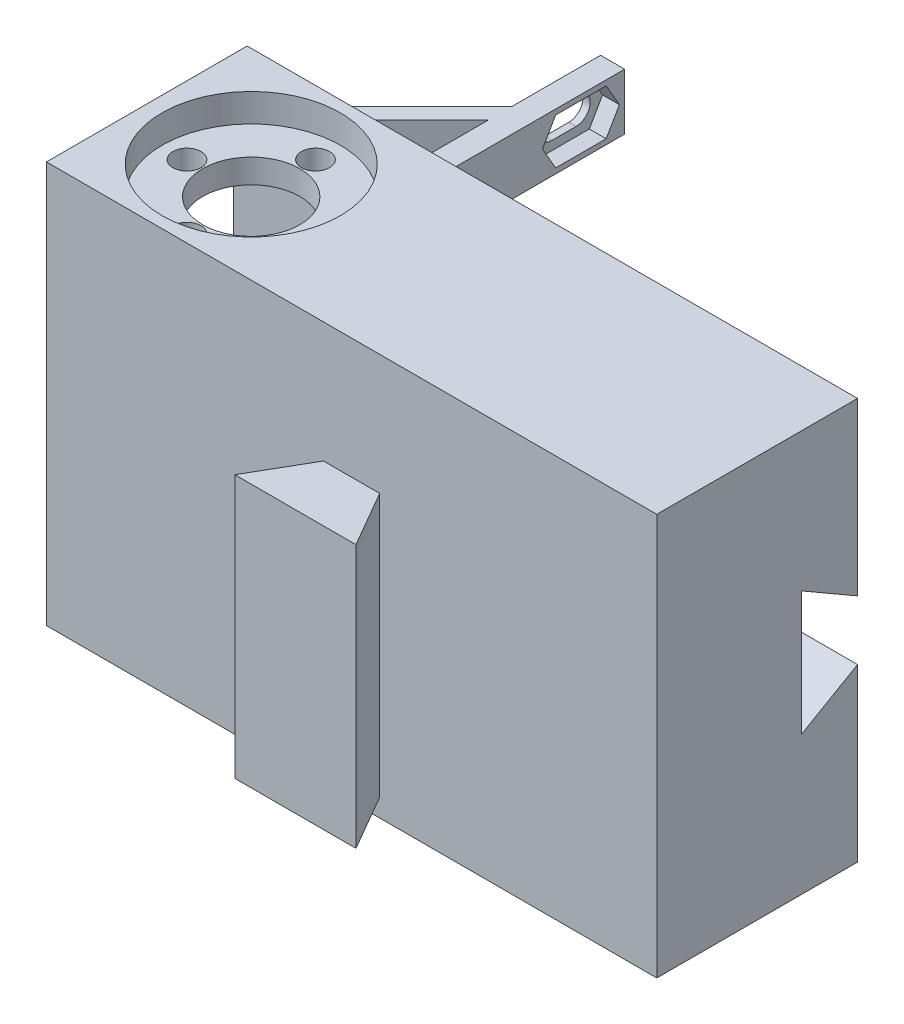
from build123d import *

# Parameters (mm, degrees)
SKETCH1_W                       = 38
SKETCH1_H                       = 50
BOSS_EXTRUDE1_DEPTH             = 25
BOSS_EXTRUDE2_START             = -22.75
BOSS_EXTRUDE2_DEPTH             = 32.75
CUT_EXTRUDE1_DEPTH              = 10
CUT_EXTRUDE2_REACH              = 88.168
CUT_EXTRUDE2_DIRECTION_2_DEPTH  = 87.168439698
SKETCH15_R                      = 11.1
CUT_EXTRUDE8_DEPTH              = 3.5
SKETCH16_R                      = 6.05
CUT_EXTRUDE9_DEPTH              = 19
SKETCH17_R                      = 6.05
CUT_EXTRUDE10_DEPTH             = 5.8
CUT_EXTRUDE11_START             = -16
CUT_EXTRUDE11_DEPTH             = 16
SKETCH19_R                      = 1.75
CUT_EXTRUDE12_DEPTH             = 19
CIRPATTERN1_COUNT               = 2
CIRPATTERN1_ANGLE               = 90
CIRPATTERN1_THE_OTHER_WAY_COUNT = 2
CIRPATTERN1_THE_OTHER_WAY_ANGLE = 90
SKETCH20_R                      = 4.15
CUT_EXTRUDE13_DEPTH             = 58.174207472
SKETCH21_R                      = 1.75
CUT_EXTRUDE14_DEPTH             = 16
SKETCH22_W                      = 3
SKETCH22_H                      = 7
BOSS_EXTRUDE5_DEPTH             = 25
CUT_EXTRUDE15_DEPTH             = 10
CUT_EXTRUDE16_START             = 2.1
CUT_EXTRUDE16_DEPTH             = 2.1
BOSS_EXTRUDE7_DEPTH             = 7
BOSS_EXTRUDE8_DEPTH             = 7


with BuildPart() as part:
    # Sketch1 → Boss-Extrude1 (new body)
    with BuildSketch(Plane.XY):
        with Locations((-19, 0)):
            Rectangle(SKETCH1_W, SKETCH1_H)
    boss_extrude1 = extrude(amount=BOSS_EXTRUDE1_DEPTH)

    # Sketch2 → Boss-Extrude2 (add)
    with BuildSketch(Plane(origin=(0, 0, 0), x_dir=(0, 0, -1), z_dir=(0, 1, 0)).offset(BOSS_EXTRUDE2_START)):
        Polygon((-25, 0), (-25, 3.5), (-32, 7.541451884), (-32, 0), align=None)
    boss_extrude2 = extrude(amount=BOSS_EXTRUDE2_DEPTH)

    # Sketch3 → Cut-Extrude1 (cut)
    with BuildSketch(Plane(origin=(0, 0, 0), x_dir=(0, 0, -1), z_dir=(1, 0, 0))):
        Polygon((0, -3.7), (0, 3.7), (-7, 7.741451884), (-7, -7.741451884), align=None)
    cut_extrude1 = extrude(amount=-CUT_EXTRUDE1_DEPTH, mode=Mode.SUBTRACT)

    # Mirror1: Boss-Extrude1, Boss-Extrude2, Cut-Extrude1 across plane
    add(boss_extrude1.mirror(Plane(origin=(0, 0, 0), x_dir=(0, 0, 1), z_dir=(1, 0, 0))))
    add(boss_extrude2.mirror(Plane(origin=(0, 0, 0), x_dir=(0, 0, 1), z_dir=(1, 0, 0))))
    add(cut_extrude1.mirror(Plane(origin=(0, 0, 0), x_dir=(0, 0, 1), z_dir=(1, 0, 0))), mode=Mode.SUBTRACT)

    # Sketch4 → Cut-Extrude2 (cut, up to next)
    with BuildSketch(Plane(origin=(38, 0, 0), x_dir=(0, 0, -1), z_dir=(1, 0, 0)), mode=Mode.PRIVATE) as cut_extrude2_sk1:
        Polygon((0, -3.7), (0, 3.7), (-7, 7.741451884), (-7, -7.741451884), align=None)
    cut_extrude2_tool1 = extrude(cut_extrude2_sk1.sketch, amount=-CUT_EXTRUDE2_REACH, mode=Mode.PRIVATE) & part.part
    add(cut_extrude2_tool1.solids().sort_by_distance((38, 0, 3.9121))[0], mode=Mode.SUBTRACT)

    # Sketch4 → Cut-Extrude2 direction 2 (cut)
    with BuildSketch(Plane(origin=(38, 0, 0), x_dir=(0, 0, -1), z_dir=(1, 0, 0))):
        Polygon((0, -3.7), (0, 3.7), (-7, 7.741451884), (-7, -7.741451884), align=None)
    extrude(amount=CUT_EXTRUDE2_DIRECTION_2_DEPTH, mode=Mode.SUBTRACT)

    # Sketch15 → Cut-Extrude8 (cut)
    with BuildSketch(Plane(origin=(0, 25, 0), x_dir=(1, 0, 0), z_dir=(0, 1, 0))):
        with Locations(Location((-25, -12.5, 0), (0, 0, 270))):
            Circle(SKETCH15_R)
    extrude(amount=-CUT_EXTRUDE8_DEPTH, mode=Mode.SUBTRACT)

    # Sketch16 → Cut-Extrude9 (cut)
    with BuildSketch(Plane(origin=(0, 21.5, 0), x_dir=(1, 0, 0), z_dir=(0, 1, 0))):
        with Locations(Location((-25, -12.5, 0), (0, 0, 270))):
            Circle(SKETCH16_R)
    extrude(amount=-CUT_EXTRUDE9_DEPTH, mode=Mode.SUBTRACT)

    # Sketch17 → Cut-Extrude10 (cut)
    # profile 1 of 2: a face of its own
    with BuildSketch(Plane(origin=(0, 2.5, 0), x_dir=(1, 0, 0), z_dir=(0, 1, 0))):
        with BuildLine():
            ThreePointArc((-25, -20), (-17.5, -12.5), (-25, -5))
            Line((-25, -5), (-38, -5))
            Line((-38, -5), (-38, -20))
            Line((-38, -20), (-25, -20))
        make_face()
        with Locations(Location((-25, -12.5, 0), (0, 0, 270))):
            Circle(SKETCH17_R, mode=Mode.SUBTRACT)
    # profile 2 of 2: a face of its own
    with BuildSketch(Plane(origin=(0, 2.5, 0), x_dir=(1, 0, 0), z_dir=(0, 1, 0))):
        with Locations(Location((-25, -12.5, 0), (0, 0, 270))):
            Circle(SKETCH17_R)
    extrude(amount=-CUT_EXTRUDE10_DEPTH, mode=Mode.SUBTRACT)

    # Sketch18 → Cut-Extrude11 (cut)
    with BuildSketch(Plane.XZ.offset(-2.5).offset(CUT_EXTRUDE11_START)):
        with BuildLine():
            Line((-25, 18.55), (-38, 18.55))
            Line((-38, 18.55), (-38, 6.45))
            Line((-38, 6.45), (-25, 6.45))
            ThreePointArc((-25, 6.45), (-18.95, 12.5), (-25, 18.55))
        make_face()
    extrude(amount=CUT_EXTRUDE11_DEPTH, mode=Mode.SUBTRACT)

    # Sketch19 → Cut-Extrude12 (cut)
    with BuildSketch(Plane(origin=(0, 21.5, 0), x_dir=(1, 0, 0), z_dir=(0, 1, 0))):
        with Locations(Location((-33, -12.5, 0), (0, 0, 270))):
            Circle(SKETCH19_R)
    cut_extrude12 = extrude(amount=-CUT_EXTRUDE12_DEPTH, mode=Mode.SUBTRACT)

    # CirPattern1: Cut-Extrude12 ×2 about axis
    cirpattern1_axis = Axis((-25, 24.978467243, 12.5), (0, 1, 0))
    for i in range(1, CIRPATTERN1_COUNT):
        add(cut_extrude12.rotate(cirpattern1_axis, i * CIRPATTERN1_ANGLE / (CIRPATTERN1_COUNT - 1)), mode=Mode.SUBTRACT)

    # CirPattern1 the other way: Cut-Extrude12 ×2 about axis
    cirpattern1_the_other_way_axis = Axis((-25, 24.978467243, 12.5), (0, -1, 0))
    for i in range(1, CIRPATTERN1_THE_OTHER_WAY_COUNT):
        add(cut_extrude12.rotate(cirpattern1_the_other_way_axis, i * CIRPATTERN1_THE_OTHER_WAY_ANGLE / (CIRPATTERN1_THE_OTHER_WAY_COUNT - 1)), mode=Mode.SUBTRACT)

    # Sketch20 → Cut-Extrude13 (cut, through all)
    with BuildSketch(Plane(origin=(0, -3.3, 0), x_dir=(1, 0, 0), z_dir=(0, 1, 0))):
        with Locations(Location((-25, -12.5, 0), (0, 0, 270))):
            Circle(SKETCH20_R)
    extrude(amount=-CUT_EXTRUDE13_DEPTH, mode=Mode.SUBTRACT)

    # Sketch21 → Cut-Extrude14 (cut)
    with BuildSketch(Plane.XZ.offset(-18.5)):
        with BuildLine():
            Line((-38, 6.45), (-38, 1.7))
            Line((-38, 1.7), (-22.2, 1.7))
            Line((-22.2, 1.7), (-22.2, 23.3))
            Line((-22.2, 23.3), (-38, 23.3))
            Line((-38, 23.3), (-38, 18.55))
            Line((-38, 18.55), (-25, 18.55))
            ThreePointArc((-25, 18.55), (-31.05, 12.5), (-25, 6.45))
            Line((-25, 6.45), (-38, 6.45))
        make_face()
        with Locations(Location((-25, 4.5, 0), (0, 0, 180))):
            Circle(SKETCH21_R, mode=Mode.SUBTRACT)
        with Locations((-25, 20.5)):
            Circle(SKETCH21_R, mode=Mode.SUBTRACT)
    extrude(amount=CUT_EXTRUDE14_DEPTH, mode=Mode.SUBTRACT)

    # Sketch22 → Boss-Extrude5 (add)
    with BuildSketch(Plane(origin=(0, 0, 0), x_dir=(-1, 0, 0), z_dir=(0, 0, -1))):
        with Locations((17.5, 17.5)):
            Rectangle(SKETCH22_W, SKETCH22_H)
        with Locations((17.5, -17.5)):
            Rectangle(SKETCH22_W, SKETCH22_H)
    extrude(amount=BOSS_EXTRUDE5_DEPTH)

    # Sketch23 → Cut-Extrude15 (cut)
    with BuildSketch(Plane.ZY.offset(19)):
        with BuildLine():
            Line((-18.05, 19.25), (-21.05, 19.25))
            ThreePointArc((-21.05, 19.25), (-22.8, 17.5), (-21.05, 15.75))
            Line((-21.05, 15.75), (-18.05, 15.75))
            ThreePointArc((-18.05, 15.75), (-16.3, 17.5), (-18.05, 19.25))
        make_face()
        with BuildLine():
            Line((-18.05, -15.75), (-21.05, -15.75))
            ThreePointArc((-21.05, -15.75), (-22.8, -17.5), (-21.05, -19.25))
            Line((-21.05, -19.25), (-18.05, -19.25))
            ThreePointArc((-18.05, -19.25), (-16.3, -17.5), (-18.05, -15.75))
        make_face()
    extrude(amount=-CUT_EXTRUDE15_DEPTH, mode=Mode.SUBTRACT)

    # Sketch24 → Cut-Extrude16 (cut)
    with BuildSketch(Plane.ZY.offset(16).offset(CUT_EXTRUDE16_START)):
        with BuildLine():
            Line((-21.05, 19.25), (-20.330533563, 19.25))
            Line((-20.330533563, 19.25), (-19.695448267, 20.35))
            Line((-19.695448267, 20.35), (-22.695448267, 20.35))
            Line((-22.695448267, 20.35), (-24.340896534, 17.5))
            Line((-24.340896534, 17.5), (-22.695448267, 14.65))
            Line((-22.695448267, 14.65), (-19.695448267, 14.65))
            Line((-19.695448267, 14.65), (-20.330533563, 15.75))
            Line((-20.330533563, 15.75), (-21.05, 15.75))
            ThreePointArc((-21.05, 15.75), (-22.8, 17.5), (-21.05, 19.25))
        make_face()
        with BuildLine():
            Line((-19.404551733, 20.35), (-18.769466437, 19.25))
            Line((-18.769466437, 19.25), (-18.05, 19.25))
            ThreePointArc((-18.05, 19.25), (-16.3, 17.5), (-18.05, 15.75))
            Line((-18.05, 15.75), (-18.769466437, 15.75))
            Line((-18.769466437, 15.75), (-19.404551733, 14.65))
            Line((-19.404551733, 14.65), (-16.404551733, 14.65))
            Line((-16.404551733, 14.65), (-14.759103466, 17.5))
            Line((-14.759103466, 17.5), (-16.404551733, 20.35))
            Line((-16.404551733, 20.35), (-19.404551733, 20.35))
        make_face()
        Polygon((-20.330533563, 19.25), (-18.769466437, 19.25), (-19.404551733, 20.35), (-19.695448267, 20.35), align=None)
        Polygon((-19.404551733, 14.65), (-18.769466437, 15.75), (-20.330533563, 15.75), (-19.695448267, 14.65), align=None)
        Polygon((-19.404551733, -20.35), (-17.759103466, -17.5), (-19.404551733, -14.65), (-19.695448267, -14.65), (-21.340896534, -17.5), (-19.695448267, -20.35), align=None)
        Polygon((-21.340896534, -17.5), (-19.695448267, -14.65), (-22.695448267, -14.65), (-24.340896534, -17.5), (-22.695448267, -20.35), (-19.695448267, -20.35), align=None)
        with BuildLine():
            Line((-19.404551733, -14.65), (-18.769466437, -15.75))
            Line((-18.769466437, -15.75), (-18.05, -15.75))
            ThreePointArc((-18.05, -15.75), (-16.3, -17.5), (-18.05, -19.25))
            Line((-18.05, -19.25), (-18.769466437, -19.25))
            Line((-18.769466437, -19.25), (-19.404551733, -20.35))
            Line((-19.404551733, -20.35), (-16.404551733, -20.35))
            Line((-16.404551733, -20.35), (-14.759103466, -17.5))
            Line((-14.759103466, -17.5), (-16.404551733, -14.65))
            Line((-16.404551733, -14.65), (-19.404551733, -14.65))
        make_face()
    extrude(amount=-CUT_EXTRUDE16_DEPTH, mode=Mode.SUBTRACT)

    # Sketch26 → Boss-Extrude7 (add)
    with BuildSketch(Plane.XZ.offset(21)):
        Polygon((-19, -14), (-33, 0), (-30, 0), (-19, -11), align=None)
    extrude(amount=-BOSS_EXTRUDE7_DEPTH)

    # Sketch28 → Boss-Extrude8 (add)
    with BuildSketch(Plane(origin=(0, 21, 0), x_dir=(1, 0, 0), z_dir=(0, 1, 0))):
        Polygon((-33, 0), (-30, 0), (-19, 11), (-19, 14), align=None)
    extrude(amount=-BOSS_EXTRUDE8_DEPTH)


solid = part.part
